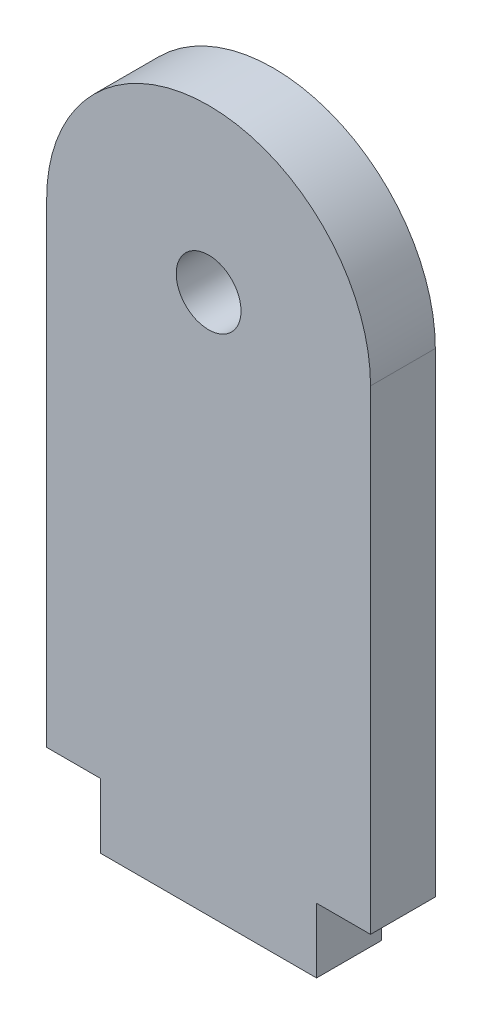
from build123d import *

# Parameters (mm, degrees)
EXTRUDE_1_DEPTH = 3


with BuildPart() as part:
    # 草图1 → 凸台-拉伸1 (new body)
    with BuildSketch(Plane.XY):
        with BuildLine():
            ThreePointArc((6, 0), (7.5, 1.5), (9, 0))
            Line((9, 0), (15, 0))
            ThreePointArc((15, 0), (7.5, 7.5), (0, 0))
            Line((0, 0), (6, 0))
        make_face()
        with BuildLine():
            ThreePointArc((9, 0), (8.560660172, -1.060660172), (7.5, -1.5))
            Line((7.5, -1.5), (7.5, -7.5))
            ThreePointArc((7.5, -7.5), (12.803300859, -5.303300859), (15, 0))
            Line((15, 0), (9, 0))
        make_face()
        with BuildLine():
            Line((7.5, -7.5), (7.5, -1.5))
            ThreePointArc((7.5, -1.5), (6.439339828, -1.060660172), (6, 0))
            Line((6, 0), (0, 0))
            ThreePointArc((0, 0), (2.196699141, -5.303300859), (7.5, -7.5))
        make_face()
        with BuildLine():
            ThreePointArc((15, 0), (12.803300859, -5.303300859), (7.5, -7.5))
            Line((7.5, -7.5), (7.5, -22))
            Line((7.5, -22), (12.5, -22))
            Line((12.5, -22), (15, -22))
            Line((15, -22), (15, 0))
        make_face()
        with BuildLine():
            Line((7.5, -22), (7.5, -7.5))
            ThreePointArc((7.5, -7.5), (2.196699141, -5.303300859), (0, 0))
            Line((0, 0), (0, -22))
            Line((0, -22), (2.5, -22))
            Line((2.5, -22), (7.5, -22))
        make_face()
        Polygon((12.5, -22), (7.5, -22), (2.5, -22), (2.5, -25), (12.5, -25), align=None)
    extrude(amount=EXTRUDE_1_DEPTH)


solid = part.part
